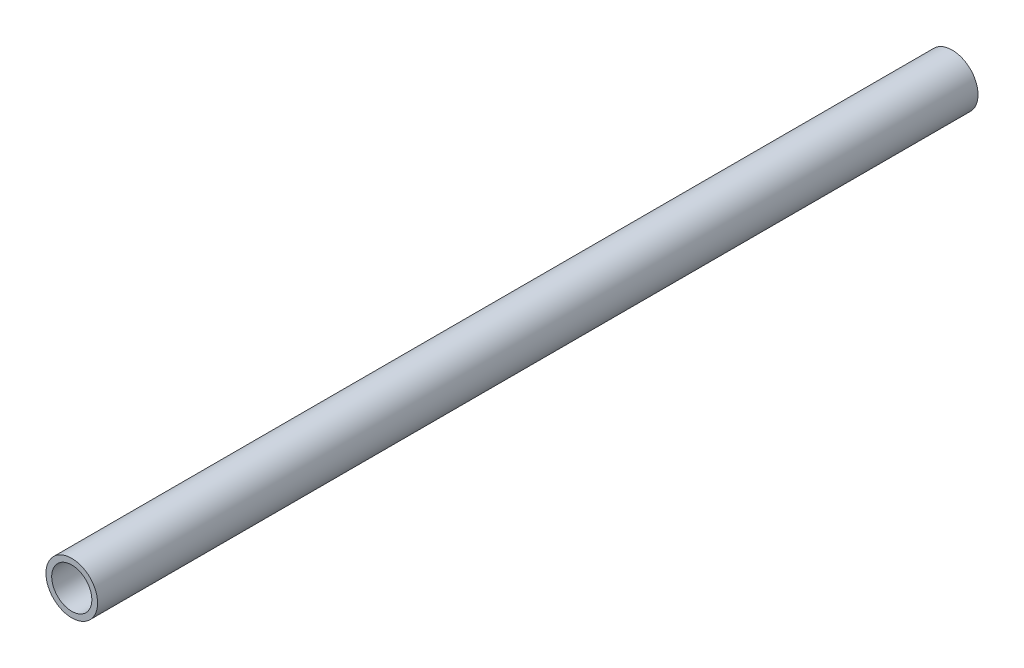
from build123d import *

# Parameters (mm, degrees)
SKETCH_1_R      = 9
SKETCH_1_R_2    = 7
EXTRUDE_1_DEPTH = 306.9


with BuildPart() as part:
    # 草图1 → 凸台-拉伸1 (new body)
    with BuildSketch(Plane.XY):
        Circle(SKETCH_1_R)
        Circle(SKETCH_1_R_2, mode=Mode.SUBTRACT)
    extrude(amount=EXTRUDE_1_DEPTH)


solid = part.part
